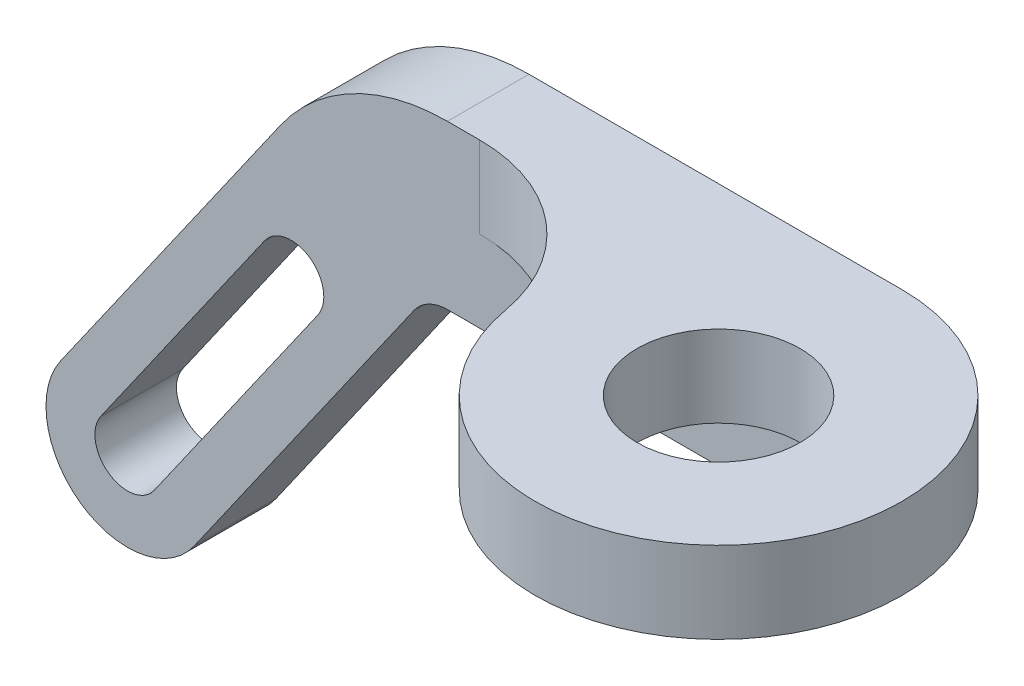
from build123d import *

# Parameters (mm, degrees)
BOSS_EXTRUDE1_DEPTH        = 10
SKETCH2_R                  = 22.5
BOSS_EXTRUDE2_DEPTH        = 10
FILLET1_R                  = 20
CUT_EXTRUDE1_DEPTH         = 87.461600391
F_20_0_20_DIAMETER_HOLE1_D = 20


with BuildPart() as part:
    # Sketch1 → Boss-Extrude1 (new body)
    with BuildSketch(Plane.XY):
        with BuildLine():
            Line((-47.428762445, -24.149122657), (-20.478801107, 14.339410909))
            ThreePointArc((-20.478801107, 14.339410909), (-11.543715331, 22.175270829), (0, 25))
            Line((0, 25), (45.762757998, 25))
            Line((45.762757998, 25), (45.762757998, 5))
            Line((45.762757998, 5), (0, 5))
            ThreePointArc((0, 5), (-2.308743066, 4.435054166), (-4.095760221, 2.867882182))
            Line((-4.095760221, 2.867882182), (-31.045721559, -35.620651384))
            ThreePointArc((-31.045721559, -35.620651384), (-44.973006365, -38.076407464), (-47.428762445, -24.149122657))
        make_face()
    extrude(amount=BOSS_EXTRUDE1_DEPTH)

    # Sketch2 → Boss-Extrude2 (add)
    with BuildSketch(Plane(origin=(0, 25, 0), x_dir=(1, 0, 0), z_dir=(0, 1, 0))):
        with Locations((45.762757998, -22.5)):
            Circle(SKETCH2_R)
    extrude(amount=-BOSS_EXTRUDE2_DEPTH)

    # Fillet1
    fillet1_edges = [part.edges().sort_by_distance(p)[0] for p in [
        (27.054471064, 20, 10),
    ]]
    fillet(fillet1_edges, radius=FILLET1_R)

    # Sketch3 → Cut-Extrude1 (cut, through all)
    with BuildSketch(Plane.XY.offset(10)):
        with BuildLine():
            Line((-42.513850179, -27.590581275), (-22.438674907, 1.079740275))
            ThreePointArc((-22.438674907, 1.079740275), (-16.867760984, 2.062042706), (-15.885458553, -3.508871216))
            Line((-15.885458553, -3.508871216), (-35.960633825, -32.179192766))
            ThreePointArc((-35.960633825, -32.179192766), (-41.531547747, -33.161495198), (-42.513850179, -27.590581275))
        make_face()
    extrude(amount=-CUT_EXTRUDE1_DEPTH, mode=Mode.SUBTRACT)

    # Ø20.0 (20) Diameter Hole1 (through all)
    with Locations(Plane(origin=(0, 25, 0), x_dir=(1, 0, 0), z_dir=(0, 1, 0))):
        with Locations((45.762757998, -22.5)):
            Hole(F_20_0_20_DIAMETER_HOLE1_D / 2)


solid = part.part
